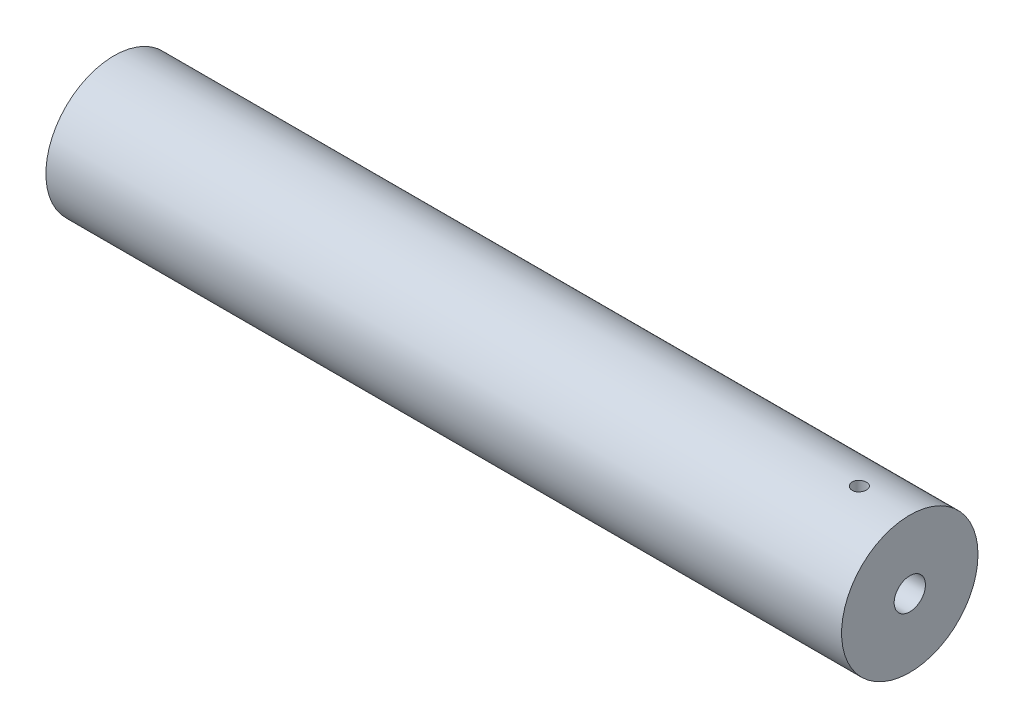
from build123d import *

# Parameters (mm, degrees)
SKETCH1_R               = 12
BOSS_EXTRUDE1_DEPTH     = 140
CUT_EXTRUDE1_DEPTH      = 120
CUT_EXTRUDE1_DEPTH_BACK = 120
SKETCH2_R               = 1.25
SKETCH3_R               = 2.75
CUT_EXTRUDE2_DEPTH      = 42
SKETCH4_R               = 4
CUT_EXTRUDE3_DEPTH      = 70


with BuildPart() as part:
    # Sketch1 → Boss-Extrude1 (new body)
    with BuildSketch(Plane(origin=(0, 0, 0), x_dir=(0, 0, -1), z_dir=(1, 0, 0))):
        Circle(SKETCH1_R)
    extrude(amount=BOSS_EXTRUDE1_DEPTH)

    # Sketch2 → Cut-Extrude1 (cut, two sides: drawn at the far end of the back side and taken through both)
    with BuildSketch(Plane(origin=(0, 0, 0), x_dir=(1, 0, 0), z_dir=(0, 1, 0)).offset(-CUT_EXTRUDE1_DEPTH_BACK)):
        with Locations((131.130079525, 0)):
            Circle(SKETCH2_R)
    extrude(amount=CUT_EXTRUDE1_DEPTH + CUT_EXTRUDE1_DEPTH_BACK, mode=Mode.SUBTRACT)

    # Sketch3 → Cut-Extrude2 (cut)
    with BuildSketch(Plane(origin=(140, 0, 0), x_dir=(0, 0, -1), z_dir=(1, 0, 0))):
        Circle(SKETCH3_R)
    extrude(amount=-CUT_EXTRUDE2_DEPTH, mode=Mode.SUBTRACT)

    # Sketch4 → Cut-Extrude3 (cut)
    with BuildSketch(Plane.ZY):
        Circle(SKETCH4_R)
    extrude(amount=-CUT_EXTRUDE3_DEPTH, mode=Mode.SUBTRACT)


solid = part.part
